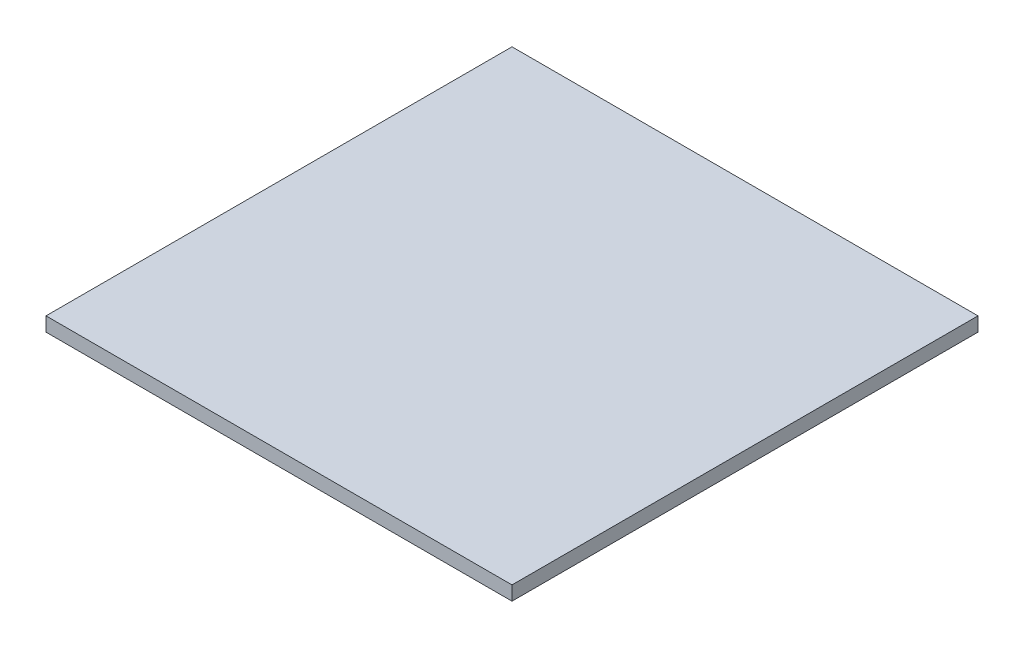
from build123d import *

# Parameters (mm, degrees)
SKETCH1_W           = 330
SKETCH1_H           = 330
BOSS_EXTRUDE1_DEPTH = 10


with BuildPart() as part:
    # Sketch1 → Boss-Extrude1 (new body)
    with BuildSketch(Plane(origin=(0, 0, 0), x_dir=(1, 0, 0), z_dir=(0, 1, 0))):
        Rectangle(SKETCH1_W, SKETCH1_H)
    extrude(amount=BOSS_EXTRUDE1_DEPTH)


solid = part.part
